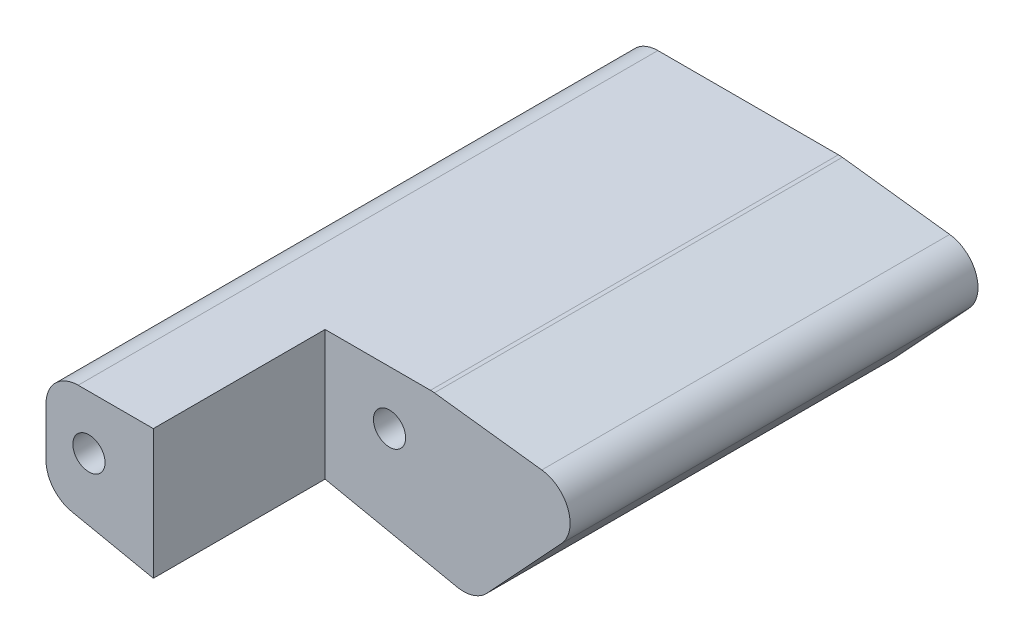
from build123d import *

# Parameters (mm, degrees)
SKETCH_1_W          = 20
SKETCH_1_H          = 10
SKETCH_1_R          = 1.5
EXTRUDE_1_DEPTH     = 54
EXTRUDE_2_DEPTH     = 54
FILLET_1_R          = 3
SKETCH_4_R          = 1.5
CUT_EXTRUDE_2_DEPTH = 16


with BuildPart() as part:
    # 草图1 → 凸台-拉伸1 (new body)
    with BuildSketch(Plane.XY):
        Rectangle(SKETCH_1_W, SKETCH_1_H)
        with Locations((-6, 0)):
            Circle(SKETCH_1_R, mode=Mode.SUBTRACT)
        with Locations((6, 0)):
            Circle(SKETCH_1_R, mode=Mode.SUBTRACT)
    extrude(amount=EXTRUDE_1_DEPTH)

    # 草图2 → 凸台-拉伸2 (add)
    with BuildSketch(Plane(origin=(0, 0, 0), x_dir=(-1, 0, 0), z_dir=(0, 0, -1))):
        Polygon((-26.016199375, 3.045755137), (-10, 5), (-10, -5), (10, -5), (-13.936339886, -9.975800078), align=None)
    extrude(amount=-EXTRUDE_2_DEPTH)

    # 圆角1
    fillet_1_edges = [part.edges().sort_by_distance(p)[0] for p in [
        (26.016199375, 3.045755137, 27),
        (13.936339886, -9.975800078, 27),
        (-10, -5, 27),
        (-10, 5, 27),
        (10, 5, 27),
    ]]
    fillet(fillet_1_edges, radius=FILLET_1_R)

    # 草图4 → 切除-拉伸2 (cut)
    with BuildSketch(Plane.XY.offset(54)):
        with BuildLine():
            Line((9.817651049, 5), (0, 5))
            Line((0, 5), (0, -7.078763964))
            Line((0, -7.078763964), (12.278210403, -9.631114097))
            ThreePointArc((12.278210403, -9.631114097), (13.801017817, -9.551847513), (15.088142689, -8.734207508))
            Line((15.088142689, -8.734207508), (22.02094679, -1.260950763))
            ThreePointArc((22.02094679, -1.260950763), (22.638947239, 1.810129636), (20.184946376, 3.757265774))
            Line((20.184946376, 3.757265774), (10.181006508, 4.977914171))
            ThreePointArc((10.181006508, 4.977914171), (9.99966408, 4.994473452), (9.817651049, 5))
        make_face()
        with Locations((6, 0)):
            Circle(SKETCH_4_R, mode=Mode.SUBTRACT)
    extrude(amount=-CUT_EXTRUDE_2_DEPTH, mode=Mode.SUBTRACT)


solid = part.part
